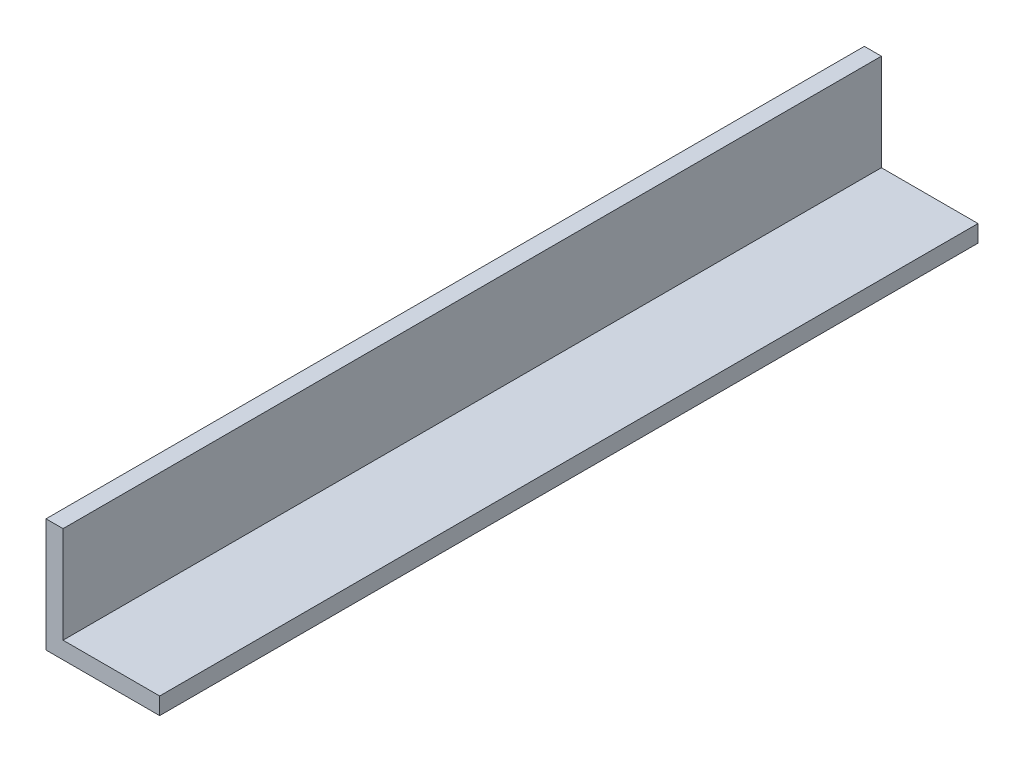
from build123d import *

# Parameters (mm, degrees)
BOSS_EXTRUDE1_DEPTH = 144


with BuildPart() as part:
    # Sketch1 → Boss-Extrude1 (new body)
    with BuildSketch(Plane.XY):
        Polygon((0, 0), (20, 0), (20, 3), (3, 3), (3, 20), (0, 20), align=None)
    extrude(amount=BOSS_EXTRUDE1_DEPTH)


solid = part.part
